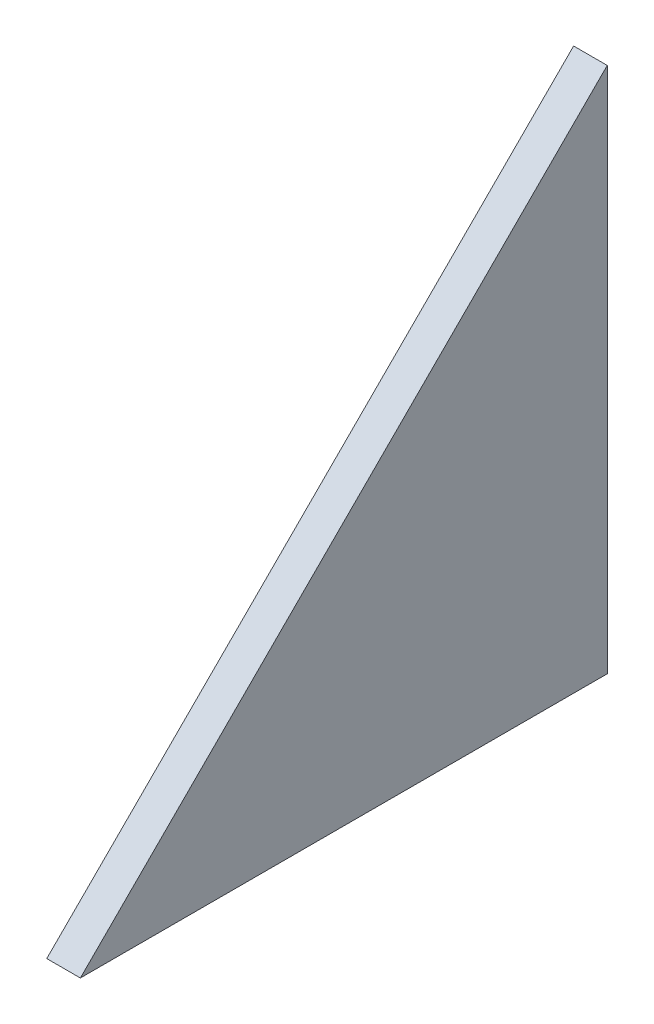
from build123d import *

# Parameters (mm, degrees)
BOSS_EXTRUDE1_DEPTH = 3


with BuildPart() as part:
    # Sketch1 → Boss-Extrude1 (new body)
    with BuildSketch(Plane(origin=(223.844609768, 0, 0), x_dir=(0, 0, -1), z_dir=(1, 0, 0))):
        Polygon((-99.99220689, 115.634949874), (-99.99220689, 68.634949874), (-146.99220689, 68.634949874), align=None)
    extrude(amount=BOSS_EXTRUDE1_DEPTH)


solid = part.part
